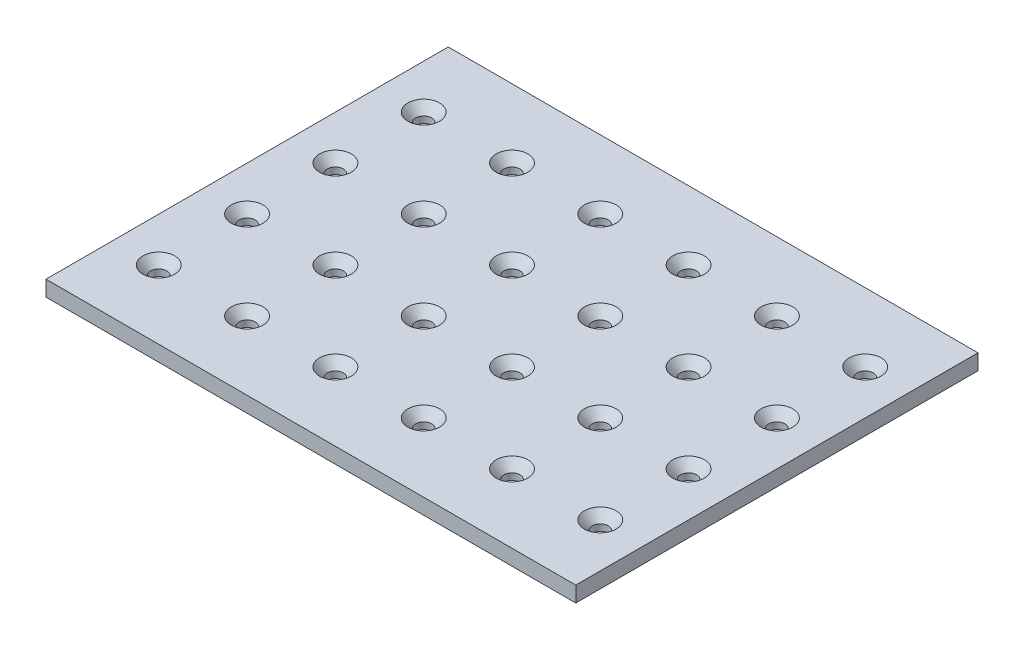
from build123d import *

# Parameters (mm, degrees)
SKETCH1_W                                     = 108
SKETCH1_H                                     = 82
SKETCH1_R                                     = 1.63195
BOSS_EXTRUDE1_DEPTH                           = 3.175
CSK_FOR_4_FLAT_HEAD_MACHINE_SCREW1_AT_2_COUNT = 2
CSK_FOR_4_FLAT_HEAD_MACHINE_SCREW1_AT_2_PITCH = 18
CSK_FOR_4_FLAT_HEAD_MACHINE_SCREW1_AT_3_COUNT = 2
CSK_FOR_4_FLAT_HEAD_MACHINE_SCREW1_AT_3_PITCH = 36
CSK_FOR_4_FLAT_HEAD_MACHINE_SCREW1_AT_4_COUNT = 2
CSK_FOR_4_FLAT_HEAD_MACHINE_SCREW1_AT_4_PITCH = 54
CSK_FOR_4_FLAT_HEAD_MACHINE_SCREW1_AT_5_COUNT = 2
CSK_FOR_4_FLAT_HEAD_MACHINE_SCREW1_AT_5_PITCH = 72
CSK_FOR_4_FLAT_HEAD_MACHINE_SCREW1_AT_6_COUNT = 2
CSK_FOR_4_FLAT_HEAD_MACHINE_SCREW1_AT_6_PITCH = 90
CSK_FOR_4_FLAT_HEAD_MACHINE_SCREW1_AT_7_COUNT = 2
CSK_FOR_4_FLAT_HEAD_MACHINE_SCREW1_AT_7_PITCH = 91.782351245
CSK_FOR_4_FLAT_HEAD_MACHINE_SCREW1_AT_8_COUNT = 2
CSK_FOR_4_FLAT_HEAD_MACHINE_SCREW1_AT_8_PITCH = 74.215901261
CSK_FOR_4_FLAT_HEAD_MACHINE_SCREW1_AT_9_COUNT = 2
CSK_FOR_4_FLAT_HEAD_MACHINE_SCREW1_AT_9_PITCH = 56.920997883
CSK_FOR_4_FLAT_HEAD_MACHINE_SCREW1_AT_1_COUNT = 2
CSK_FOR_4_FLAT_HEAD_MACHINE_SCREW1_AT_1_PITCH = 40.249223595
CSK_FOR_4_FLAT_HEAD_MACHINE_SCREW1_2_COUNT    = 2
CSK_FOR_4_FLAT_HEAD_MACHINE_SCREW1_2_PITCH    = 25.455844123
CSK_FOR_4_FLAT_HEAD_MACHINE_SCREW1_3_COUNT    = 2
CSK_FOR_4_FLAT_HEAD_MACHINE_SCREW1_3_PITCH    = 18
CSK_FOR_4_FLAT_HEAD_MACHINE_SCREW1_4_COUNT    = 2
CSK_FOR_4_FLAT_HEAD_MACHINE_SCREW1_4_PITCH    = 36
CSK_FOR_4_FLAT_HEAD_MACHINE_SCREW1_5_COUNT    = 2
CSK_FOR_4_FLAT_HEAD_MACHINE_SCREW1_5_PITCH    = 40.249223595
CSK_FOR_4_FLAT_HEAD_MACHINE_SCREW1_6_COUNT    = 2
CSK_FOR_4_FLAT_HEAD_MACHINE_SCREW1_6_PITCH    = 50.911688245
CSK_FOR_4_FLAT_HEAD_MACHINE_SCREW1_7_COUNT    = 2
CSK_FOR_4_FLAT_HEAD_MACHINE_SCREW1_7_PITCH    = 64.899922958
CSK_FOR_4_FLAT_HEAD_MACHINE_SCREW1_8_COUNT    = 2
CSK_FOR_4_FLAT_HEAD_MACHINE_SCREW1_8_PITCH    = 80.49844719
CSK_FOR_4_FLAT_HEAD_MACHINE_SCREW1_9_COUNT    = 2
CSK_FOR_4_FLAT_HEAD_MACHINE_SCREW1_9_PITCH    = 96.932966528
CSK_FOR_4_FLAT_HEAD_MACHINE_SCREW1_10_COUNT   = 2
CSK_FOR_4_FLAT_HEAD_MACHINE_SCREW1_10_PITCH   = 104.957134107
CSK_FOR_4_FLAT_HEAD_MACHINE_SCREW1_11_COUNT   = 2
CSK_FOR_4_FLAT_HEAD_MACHINE_SCREW1_11_PITCH   = 90
CSK_FOR_4_FLAT_HEAD_MACHINE_SCREW1_12_COUNT   = 2
CSK_FOR_4_FLAT_HEAD_MACHINE_SCREW1_12_PITCH   = 76.367532368
CSK_FOR_4_FLAT_HEAD_MACHINE_SCREW1_13_COUNT   = 2
CSK_FOR_4_FLAT_HEAD_MACHINE_SCREW1_13_PITCH   = 64.899922958
CSK_FOR_4_FLAT_HEAD_MACHINE_SCREW1_14_COUNT   = 2
CSK_FOR_4_FLAT_HEAD_MACHINE_SCREW1_14_PITCH   = 56.920997883
CSK_FOR_4_FLAT_HEAD_MACHINE_SCREW1_15_COUNT   = 2
CSK_FOR_4_FLAT_HEAD_MACHINE_SCREW1_15_PITCH   = 54


with BuildPart() as part:
    # Sketch1 → Boss-Extrude1 (new body)
    with BuildSketch(Plane(origin=(0, 0, 0), x_dir=(1, 0, 0), z_dir=(0, 1, 0))):
        Rectangle(SKETCH1_W, SKETCH1_H)
        with Locations(Location((-45, 27, 0), (0, 0, 270))):
            Circle(SKETCH1_R, mode=Mode.SUBTRACT)
        with Locations(Location((-27, 27, 0), (0, 0, 270))):
            Circle(SKETCH1_R, mode=Mode.SUBTRACT)
        with Locations(Location((-9, 27, 0), (0, 0, 270))):
            Circle(SKETCH1_R, mode=Mode.SUBTRACT)
        with Locations(Location((9, 27, 0), (0, 0, 270))):
            Circle(SKETCH1_R, mode=Mode.SUBTRACT)
        with Locations(Location((27, 27, 0), (0, 0, 270))):
            Circle(SKETCH1_R, mode=Mode.SUBTRACT)
        with Locations(Location((45, 27, 0), (0, 0, 270))):
            Circle(SKETCH1_R, mode=Mode.SUBTRACT)
        with Locations(Location((-27, 9, 0), (0, 0, 270))):
            Circle(SKETCH1_R, mode=Mode.SUBTRACT)
        with Locations(Location((-9, 9, 0), (0, 0, 270))):
            Circle(SKETCH1_R, mode=Mode.SUBTRACT)
        with Locations(Location((9, 9, 0), (0, 0, 270))):
            Circle(SKETCH1_R, mode=Mode.SUBTRACT)
        with Locations(Location((27, 9, 0), (0, 0, 270))):
            Circle(SKETCH1_R, mode=Mode.SUBTRACT)
        with Locations(Location((45, 9, 0), (0, 0, 270))):
            Circle(SKETCH1_R, mode=Mode.SUBTRACT)
        with Locations(Location((-27, -9, 0), (0, 0, 270))):
            Circle(SKETCH1_R, mode=Mode.SUBTRACT)
        with Locations(Location((-9, -9, 0), (0, 0, 270))):
            Circle(SKETCH1_R, mode=Mode.SUBTRACT)
        with Locations(Location((9, -9, 0), (0, 0, 270))):
            Circle(SKETCH1_R, mode=Mode.SUBTRACT)
        with Locations(Location((27, -9, 0), (0, 0, 270))):
            Circle(SKETCH1_R, mode=Mode.SUBTRACT)
        with Locations(Location((45, -9, 0), (0, 0, 270))):
            Circle(SKETCH1_R, mode=Mode.SUBTRACT)
        with Locations(Location((-27, -27, 0), (0, 0, 270))):
            Circle(SKETCH1_R, mode=Mode.SUBTRACT)
        with Locations(Location((-9, -27, 0), (0, 0, 270))):
            Circle(SKETCH1_R, mode=Mode.SUBTRACT)
        with Locations(Location((9, -27, 0), (0, 0, 270))):
            Circle(SKETCH1_R, mode=Mode.SUBTRACT)
        with Locations(Location((27, -27, 0), (0, 0, 270))):
            Circle(SKETCH1_R, mode=Mode.SUBTRACT)
        with Locations(Location((45, -27, 0), (0, 0, 270))):
            Circle(SKETCH1_R, mode=Mode.SUBTRACT)
        with Locations(Location((-45, 9, 0), (0, 0, 270))):
            Circle(SKETCH1_R, mode=Mode.SUBTRACT)
        with Locations(Location((-45, -9, 0), (0, 0, 270))):
            Circle(SKETCH1_R, mode=Mode.SUBTRACT)
        with Locations(Location((-45, -27, 0), (0, 0, 270))):
            Circle(SKETCH1_R, mode=Mode.SUBTRACT)
    extrude(amount=BOSS_EXTRUDE1_DEPTH)

    # Sketch3 → CSK for #4 Flat Head Machine Screw1 (revolve, cut)
    with BuildSketch(Plane(origin=(45, 3.175, 27), x_dir=(0, 0, 1), z_dir=(1, 0, 0))):
        Polygon((0, 0), (0, 3.175), (1.63195, 3.175), (1.63195, 1.848124365), (3.2385, 0), align=None)
    csk_for_4_flat_head_machine_screw1 = revolve(axis=Axis((45, 9.525, 27), (0, -1, 0)), mode=Mode.SUBTRACT)

    # CSK for #4 Flat Head Machine Screw1 at 2: CSK for #4 Flat Head Machine Screw1 ×2
    with Locations(*[(-i * CSK_FOR_4_FLAT_HEAD_MACHINE_SCREW1_AT_2_PITCH, 0, 0) for i in range(1, CSK_FOR_4_FLAT_HEAD_MACHINE_SCREW1_AT_2_COUNT)]):
        add(csk_for_4_flat_head_machine_screw1, mode=Mode.SUBTRACT)

    # CSK for #4 Flat Head Machine Screw1 at 3: CSK for #4 Flat Head Machine Screw1 ×2
    with Locations(*[(-i * CSK_FOR_4_FLAT_HEAD_MACHINE_SCREW1_AT_3_PITCH, 0, 0) for i in range(1, CSK_FOR_4_FLAT_HEAD_MACHINE_SCREW1_AT_3_COUNT)]):
        add(csk_for_4_flat_head_machine_screw1, mode=Mode.SUBTRACT)

    # CSK for #4 Flat Head Machine Screw1 at 4: CSK for #4 Flat Head Machine Screw1 ×2
    with Locations(*[(-i * CSK_FOR_4_FLAT_HEAD_MACHINE_SCREW1_AT_4_PITCH, 0, 0) for i in range(1, CSK_FOR_4_FLAT_HEAD_MACHINE_SCREW1_AT_4_COUNT)]):
        add(csk_for_4_flat_head_machine_screw1, mode=Mode.SUBTRACT)

    # CSK for #4 Flat Head Machine Screw1 at 5: CSK for #4 Flat Head Machine Screw1 ×2
    with Locations(*[(-i * CSK_FOR_4_FLAT_HEAD_MACHINE_SCREW1_AT_5_PITCH, 0, 0) for i in range(1, CSK_FOR_4_FLAT_HEAD_MACHINE_SCREW1_AT_5_COUNT)]):
        add(csk_for_4_flat_head_machine_screw1, mode=Mode.SUBTRACT)

    # CSK for #4 Flat Head Machine Screw1 at 6: CSK for #4 Flat Head Machine Screw1 ×2
    with Locations(*[(-i * CSK_FOR_4_FLAT_HEAD_MACHINE_SCREW1_AT_6_PITCH, 0, 0) for i in range(1, CSK_FOR_4_FLAT_HEAD_MACHINE_SCREW1_AT_6_COUNT)]):
        add(csk_for_4_flat_head_machine_screw1, mode=Mode.SUBTRACT)

    # CSK for #4 Flat Head Machine Screw1 at 7: CSK for #4 Flat Head Machine Screw1 ×2
    with Locations(*[Vector(-0.9805806756909203, 0, -0.1961161351381836) * (i * CSK_FOR_4_FLAT_HEAD_MACHINE_SCREW1_AT_7_PITCH) for i in range(1, CSK_FOR_4_FLAT_HEAD_MACHINE_SCREW1_AT_7_COUNT)]):
        add(csk_for_4_flat_head_machine_screw1, mode=Mode.SUBTRACT)

    # CSK for #4 Flat Head Machine Screw1 at 8: CSK for #4 Flat Head Machine Screw1 ×2
    with Locations(*[Vector(-0.9701425001453321, 0, -0.24253562503633236) * (i * CSK_FOR_4_FLAT_HEAD_MACHINE_SCREW1_AT_8_PITCH) for i in range(1, CSK_FOR_4_FLAT_HEAD_MACHINE_SCREW1_AT_8_COUNT)]):
        add(csk_for_4_flat_head_machine_screw1, mode=Mode.SUBTRACT)

    # CSK for #4 Flat Head Machine Screw1 at 9: CSK for #4 Flat Head Machine Screw1 ×2
    with Locations(*[Vector(-0.9486832980505142, 0, -0.31622776601683683) * (i * CSK_FOR_4_FLAT_HEAD_MACHINE_SCREW1_AT_9_PITCH) for i in range(1, CSK_FOR_4_FLAT_HEAD_MACHINE_SCREW1_AT_9_COUNT)]):
        add(csk_for_4_flat_head_machine_screw1, mode=Mode.SUBTRACT)

    # CSK for #4 Flat Head Machine Screw1 at 1: CSK for #4 Flat Head Machine Screw1 ×2
    with Locations(*[Vector(-0.894427190999917, 0, -0.44721359549995593) * (i * CSK_FOR_4_FLAT_HEAD_MACHINE_SCREW1_AT_1_PITCH) for i in range(1, CSK_FOR_4_FLAT_HEAD_MACHINE_SCREW1_AT_1_COUNT)]):
        add(csk_for_4_flat_head_machine_screw1, mode=Mode.SUBTRACT)

    # CSK for #4 Flat Head Machine Screw1  2: CSK for #4 Flat Head Machine Screw1 ×2
    with Locations(*[Vector(-0.7071067811865515, 0, -0.7071067811865436) * (i * CSK_FOR_4_FLAT_HEAD_MACHINE_SCREW1_2_PITCH) for i in range(1, CSK_FOR_4_FLAT_HEAD_MACHINE_SCREW1_2_COUNT)]):
        add(csk_for_4_flat_head_machine_screw1, mode=Mode.SUBTRACT)

    # CSK for #4 Flat Head Machine Screw1  3: CSK for #4 Flat Head Machine Screw1 ×2
    with Locations(*[(0, 0, -i * CSK_FOR_4_FLAT_HEAD_MACHINE_SCREW1_3_PITCH) for i in range(1, CSK_FOR_4_FLAT_HEAD_MACHINE_SCREW1_3_COUNT)]):
        add(csk_for_4_flat_head_machine_screw1, mode=Mode.SUBTRACT)

    # CSK for #4 Flat Head Machine Screw1  4: CSK for #4 Flat Head Machine Screw1 ×2
    with Locations(*[(0, 0, -i * CSK_FOR_4_FLAT_HEAD_MACHINE_SCREW1_4_PITCH) for i in range(1, CSK_FOR_4_FLAT_HEAD_MACHINE_SCREW1_4_COUNT)]):
        add(csk_for_4_flat_head_machine_screw1, mode=Mode.SUBTRACT)

    # CSK for #4 Flat Head Machine Screw1  5: CSK for #4 Flat Head Machine Screw1 ×2
    with Locations(*[Vector(-0.44721359549996553, 0, -0.8944271909999122) * (i * CSK_FOR_4_FLAT_HEAD_MACHINE_SCREW1_5_PITCH) for i in range(1, CSK_FOR_4_FLAT_HEAD_MACHINE_SCREW1_5_COUNT)]):
        add(csk_for_4_flat_head_machine_screw1, mode=Mode.SUBTRACT)

    # CSK for #4 Flat Head Machine Screw1  6: CSK for #4 Flat Head Machine Screw1 ×2
    with Locations(*[Vector(-0.7071067811865513, 0, -0.7071067811865437) * (i * CSK_FOR_4_FLAT_HEAD_MACHINE_SCREW1_6_PITCH) for i in range(1, CSK_FOR_4_FLAT_HEAD_MACHINE_SCREW1_6_COUNT)]):
        add(csk_for_4_flat_head_machine_screw1, mode=Mode.SUBTRACT)

    # CSK for #4 Flat Head Machine Screw1  7: CSK for #4 Flat Head Machine Screw1 ×2
    with Locations(*[Vector(-0.8320502943378456, 0, -0.5547001962252264) * (i * CSK_FOR_4_FLAT_HEAD_MACHINE_SCREW1_7_PITCH) for i in range(1, CSK_FOR_4_FLAT_HEAD_MACHINE_SCREW1_7_COUNT)]):
        add(csk_for_4_flat_head_machine_screw1, mode=Mode.SUBTRACT)

    # CSK for #4 Flat Head Machine Screw1  8: CSK for #4 Flat Head Machine Screw1 ×2
    with Locations(*[Vector(-0.894427190999917, 0, -0.447213595499956) * (i * CSK_FOR_4_FLAT_HEAD_MACHINE_SCREW1_8_PITCH) for i in range(1, CSK_FOR_4_FLAT_HEAD_MACHINE_SCREW1_8_COUNT)]):
        add(csk_for_4_flat_head_machine_screw1, mode=Mode.SUBTRACT)

    # CSK for #4 Flat Head Machine Screw1  9: CSK for #4 Flat Head Machine Screw1 ×2
    with Locations(*[Vector(-0.9284766908852599, 0, -0.37139067635410233) * (i * CSK_FOR_4_FLAT_HEAD_MACHINE_SCREW1_9_PITCH) for i in range(1, CSK_FOR_4_FLAT_HEAD_MACHINE_SCREW1_9_COUNT)]):
        add(csk_for_4_flat_head_machine_screw1, mode=Mode.SUBTRACT)

    # CSK for #4 Flat Head Machine Screw1  10: CSK for #4 Flat Head Machine Screw1 ×2
    with Locations(*[Vector(-0.8574929257125457, 0, -0.514495755427524) * (i * CSK_FOR_4_FLAT_HEAD_MACHINE_SCREW1_10_PITCH) for i in range(1, CSK_FOR_4_FLAT_HEAD_MACHINE_SCREW1_10_COUNT)]):
        add(csk_for_4_flat_head_machine_screw1, mode=Mode.SUBTRACT)

    # CSK for #4 Flat Head Machine Screw1  11: CSK for #4 Flat Head Machine Screw1 ×2
    with Locations(*[Vector(-0.8000000000000023, 0, -0.5999999999999969) * (i * CSK_FOR_4_FLAT_HEAD_MACHINE_SCREW1_11_PITCH) for i in range(1, CSK_FOR_4_FLAT_HEAD_MACHINE_SCREW1_11_COUNT)]):
        add(csk_for_4_flat_head_machine_screw1, mode=Mode.SUBTRACT)

    # CSK for #4 Flat Head Machine Screw1  12: CSK for #4 Flat Head Machine Screw1 ×2
    with Locations(*[Vector(-0.7071067811865513, 0, -0.7071067811865438) * (i * CSK_FOR_4_FLAT_HEAD_MACHINE_SCREW1_12_PITCH) for i in range(1, CSK_FOR_4_FLAT_HEAD_MACHINE_SCREW1_12_COUNT)]):
        add(csk_for_4_flat_head_machine_screw1, mode=Mode.SUBTRACT)

    # CSK for #4 Flat Head Machine Screw1  13: CSK for #4 Flat Head Machine Screw1 ×2
    with Locations(*[Vector(-0.5547001962252354, 0, -0.8320502943378396) * (i * CSK_FOR_4_FLAT_HEAD_MACHINE_SCREW1_13_PITCH) for i in range(1, CSK_FOR_4_FLAT_HEAD_MACHINE_SCREW1_13_COUNT)]):
        add(csk_for_4_flat_head_machine_screw1, mode=Mode.SUBTRACT)

    # CSK for #4 Flat Head Machine Screw1  14: CSK for #4 Flat Head Machine Screw1 ×2
    with Locations(*[Vector(-0.31622776601684705, 0, -0.9486832980505108) * (i * CSK_FOR_4_FLAT_HEAD_MACHINE_SCREW1_14_PITCH) for i in range(1, CSK_FOR_4_FLAT_HEAD_MACHINE_SCREW1_14_COUNT)]):
        add(csk_for_4_flat_head_machine_screw1, mode=Mode.SUBTRACT)

    # CSK for #4 Flat Head Machine Screw1  15: CSK for #4 Flat Head Machine Screw1 ×2
    with Locations(*[(0, 0, -i * CSK_FOR_4_FLAT_HEAD_MACHINE_SCREW1_15_PITCH) for i in range(1, CSK_FOR_4_FLAT_HEAD_MACHINE_SCREW1_15_COUNT)]):
        add(csk_for_4_flat_head_machine_screw1, mode=Mode.SUBTRACT)


solid = part.part
